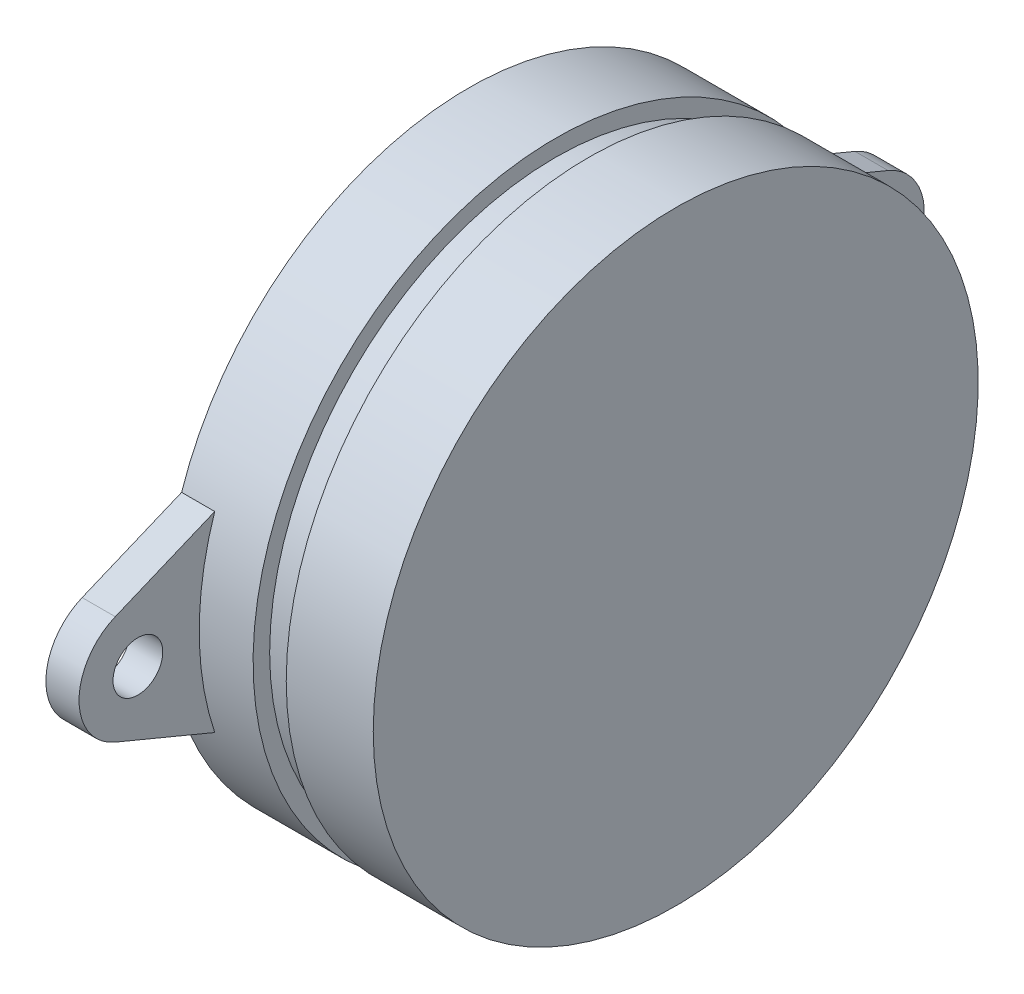
from build123d import *

# Parameters (mm, degrees)
ESQUISSE2_R             = 18.25
BOSS_EXTRU_1_DEPTH      = 5.25
ESQUISSE3_R             = 17.25
BOSS_EXTRU_2_DEPTH      = 2
ESQUISSE4_R             = 18.25
BOSS_EXTRU_3_DEPTH      = 5.25
ESQUISSE6_R             = 1.5
BOSS_EXTRU_4_DEPTH      = 2
ESQUISSE7_R             = 8
BOSS_EXTRU_5_DEPTH      = 2
ESQUISSE8_R             = 2.5
BOSS_EXTRU_6_DEPTH      = 10.5
CHANFREIN1_SIZE         = 0.25
ESQUISSE9_W             = 5
ESQUISSE9_H             = 1
ENL_V_MAT_EXTRU_1_DEPTH = 5


with BuildPart() as part:
    # Esquisse2 → Boss.-Extru.1 (new body)
    with BuildSketch(Plane(origin=(0, 0, 0), x_dir=(0, 0, -1), z_dir=(1, 0, 0))):
        with Locations(Location((0, 0, 0), (0, 0, 180))):
            Circle(ESQUISSE2_R)
    extrude(amount=BOSS_EXTRU_1_DEPTH)

    # Esquisse3 → Boss.-Extru.2 (add)
    with BuildSketch(Plane(origin=(5.25, 0, 0), x_dir=(0, 0, -1), z_dir=(1, 0, 0))):
        Circle(ESQUISSE3_R)
    extrude(amount=BOSS_EXTRU_2_DEPTH)

    # Esquisse4 → Boss.-Extru.3 (add)
    with BuildSketch(Plane(origin=(7.25, 0, 0), x_dir=(0, 0, -1), z_dir=(1, 0, 0))):
        with Locations(Location((0, 0, 0), (0, 0, 180))):
            Circle(ESQUISSE4_R)
    extrude(amount=BOSS_EXTRU_3_DEPTH)

    # Esquisse6 → Boss.-Extru.4 (add)
    # profile 1 of 2: a face of its own
    with BuildSketch(Plane.ZY):
        with BuildLine():
            ThreePointArc((23.313667029, -3.27763821), (25.5, 0), (23.313667029, 3.27763821))
            Line((23.313667029, 3.27763821), (17.312357631, 5.774493333))
            ThreePointArc((17.312357631, 5.774493333), (18.014064322, 2.925061814), (18.25, 0))
            ThreePointArc((18.25, 0), (18.014064322, -2.925061814), (17.312357631, -5.774493333))
            Line((17.312357631, -5.774493333), (23.313667029, -3.27763821))
        make_face()
        with Locations((21.95, 0)):
            Circle(ESQUISSE6_R, mode=Mode.SUBTRACT)
    # profile 2 of 2: a face of its own
    with BuildSketch(Plane.ZY):
        with BuildLine():
            ThreePointArc((-17.312357631, -5.774493333), (-18.25, 0), (-17.312357631, 5.774493333))
            Line((-17.312357631, 5.774493333), (-23.313667029, 3.27763821))
            ThreePointArc((-23.313667029, 3.27763821), (-25.5, 0), (-23.313667029, -3.27763821))
            Line((-23.313667029, -3.27763821), (-17.312357631, -5.774493333))
        make_face()
        with Locations((-21.95, 0)):
            Circle(ESQUISSE6_R, mode=Mode.SUBTRACT)
    extrude(amount=-BOSS_EXTRU_4_DEPTH)

    # Esquisse7 → Boss.-Extru.5 (add)
    with BuildSketch(Plane.ZY):
        Circle(ESQUISSE7_R)
    extrude(amount=BOSS_EXTRU_5_DEPTH)

    # Esquisse8 → Boss.-Extru.6 (add)
    with BuildSketch(Plane.ZY):
        with Locations(Location((0, 0, 0), (0, 0, 180))):
            Circle(ESQUISSE8_R)
    extrude(amount=BOSS_EXTRU_6_DEPTH)

    # Chanfrein1
    chanfrein1_edges = [part.edges().sort_by_distance(p)[0] for p in [
        (-10.5, 0, 2.5),
    ]]
    chamfer(chanfrein1_edges, length=CHANFREIN1_SIZE)

    # Esquisse9 → Enlèv. mat.-Extru.1 (cut)
    with BuildSketch(Plane.ZY.offset(10.5)):
        with Locations((0, 2.5)):
            Rectangle(ESQUISSE9_W, ESQUISSE9_H)
    extrude(amount=-ENL_V_MAT_EXTRU_1_DEPTH, mode=Mode.SUBTRACT)


solid = part.part
